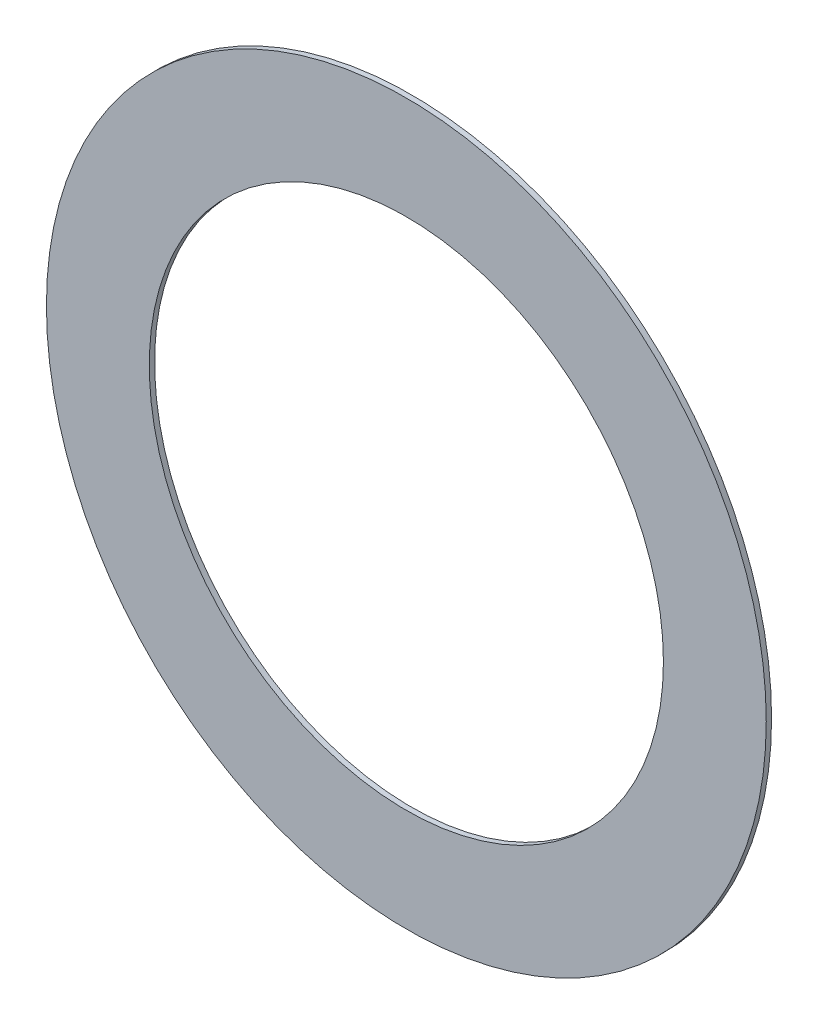
from build123d import *

# Parameters (mm, degrees)
SKETCH1_R    = 203
SKETCH1_R_2  = 145
GASKET_DEPTH = 3


with BuildPart() as part:
    # Sketch1 → Gasket (new body)
    with BuildSketch(Plane.XY):
        Circle(SKETCH1_R)
        Circle(SKETCH1_R_2, mode=Mode.SUBTRACT)
    extrude(amount=GASKET_DEPTH)


solid = part.part
